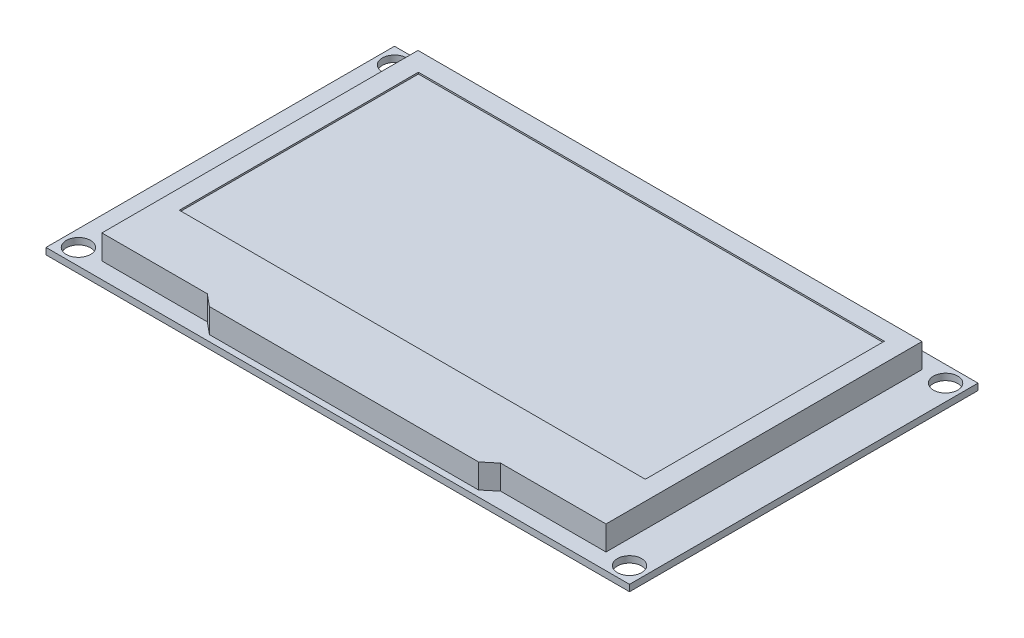
from build123d import *

# Parameters (mm, degrees)
SKETCH1_W           = 72
SKETCH1_H           = 43
SKETCH1_R           = 1.5
BOSS_EXTRUDE1_DEPTH = 0.8
SKETCH2_W           = 62.2
SKETCH2_H           = 39
SKETCH2_W_2         = 33.2
SKETCH2_H_2         = 1.237316914
BOSS_EXTRUDE2_DEPTH = 3
SKETCH3_W           = 57.5
SKETCH3_H           = 29.5
CUT_EXTRUDE1_DEPTH  = 0.2
SKETCH4_W           = 2.5
SKETCH4_H           = 17.5
BOSS_EXTRUDE3_DEPTH = 2.5
SKETCH5_W           = 0.5
SKETCH5_H           = 0.5
BOSS_EXTRUDE4_DEPTH = 6
LPATTERN1_COUNT     = 7
LPATTERN1_PITCH     = 2.5


with BuildPart() as part:
    # Sketch1 → Boss-Extrude1 (new body)
    with BuildSketch(Plane(origin=(0, 0, 0), x_dir=(1, 0, 0), z_dir=(0, 1, 0))):
        with Locations((-36, 21.5)):
            Rectangle(SKETCH1_W, SKETCH1_H)
        with Locations(Location((-70, 41, 0), (0, 0, 270))):
            Circle(SKETCH1_R, mode=Mode.SUBTRACT)
        with Locations(Location((-2, 41, 0), (0, 0, 270))):
            Circle(SKETCH1_R, mode=Mode.SUBTRACT)
        with Locations(Location((-2, 2, 0), (0, 0, 270))):
            Circle(SKETCH1_R, mode=Mode.SUBTRACT)
        with Locations(Location((-70, 2, 0), (0, 0, 270))):
            Circle(SKETCH1_R, mode=Mode.SUBTRACT)
    extrude(amount=BOSS_EXTRUDE1_DEPTH)

    # Sketch2 → Boss-Extrude2 (add)
    with BuildSketch(Plane(origin=(0, 0.8, 0), x_dir=(1, 0, 0), z_dir=(0, 1, 0))):
        with Locations((-36, 21.5)):
            Rectangle(SKETCH2_W, SKETCH2_H)
        with Locations((-36, 1.381341543)):
            Rectangle(SKETCH2_W_2, SKETCH2_H_2)
        Polygon((-19.4, 0.762683086), (-17.9, 2), (-19.4, 2), align=None)
        Polygon((-52.6, 2), (-54.1, 2), (-52.6, 0.762683086), align=None)
    extrude(amount=BOSS_EXTRUDE2_DEPTH)

    # Sketch3 → Cut-Extrude1 (cut)
    with BuildSketch(Plane(origin=(0, 3.8, 0), x_dir=(1, 0, 0), z_dir=(0, 1, 0))):
        with Locations((-36, 23.95)):
            Rectangle(SKETCH3_W, SKETCH3_H)
    extrude(amount=-CUT_EXTRUDE1_DEPTH, mode=Mode.SUBTRACT)

    # Sketch4 → Boss-Extrude3 (add)
    with BuildSketch(Plane.XZ):
        with Locations((-69.75, -21.5)):
            Rectangle(SKETCH4_W, SKETCH4_H)
    extrude(amount=BOSS_EXTRUDE3_DEPTH)

    # Sketch5 → Boss-Extrude4 (add)
    with BuildSketch(Plane.XZ.offset(2.5)):
        with Locations((-69.75, -14)):
            Rectangle(SKETCH5_W, SKETCH5_H)
    boss_extrude4 = extrude(amount=BOSS_EXTRUDE4_DEPTH)

    # LPattern1: Boss-Extrude4 ×7
    with Locations(*[(0, 0, -i * LPATTERN1_PITCH) for i in range(1, LPATTERN1_COUNT)]):
        add(boss_extrude4)


solid = part.part
